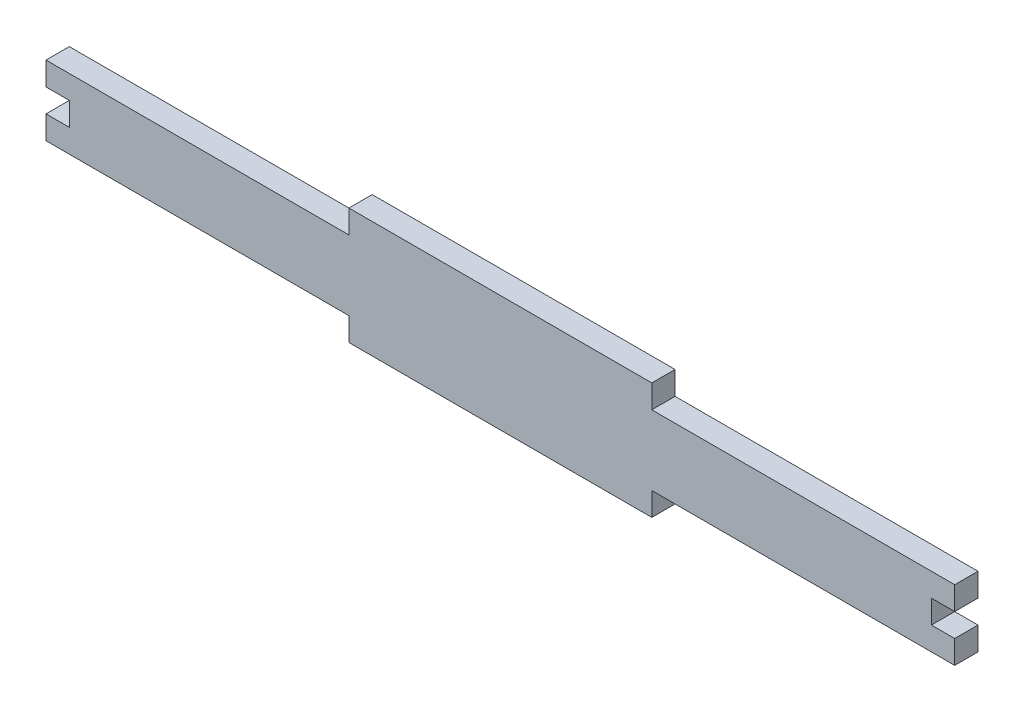
from build123d import *

# Parameters (mm, degrees)
BOSS_EXTRUDE1_DEPTH = 3


with BuildPart() as part:
    # Sketch1 → Boss-Extrude1 (new body)
    with BuildSketch(Plane.XY):
        Polygon((-19.5, -7.5), (19.5, -7.5), (19.5, -4.5), (58.5, -4.5), (58.5, -1.5), (55.5, -1.5), (55.5, 1.5), (58.5, 1.5), (58.5, 4.5), (19.5, 4.5), (19.5, 7.5), (-19.5, 7.5), (-19.5, 4.5), (-58.5, 4.5), (-58.5, 1.5), (-55.5, 1.5), (-55.5, -1.5), (-58.5, -1.5), (-58.5, -4.5), (-19.5, -4.5), align=None)
    extrude(amount=BOSS_EXTRUDE1_DEPTH)


solid = part.part
